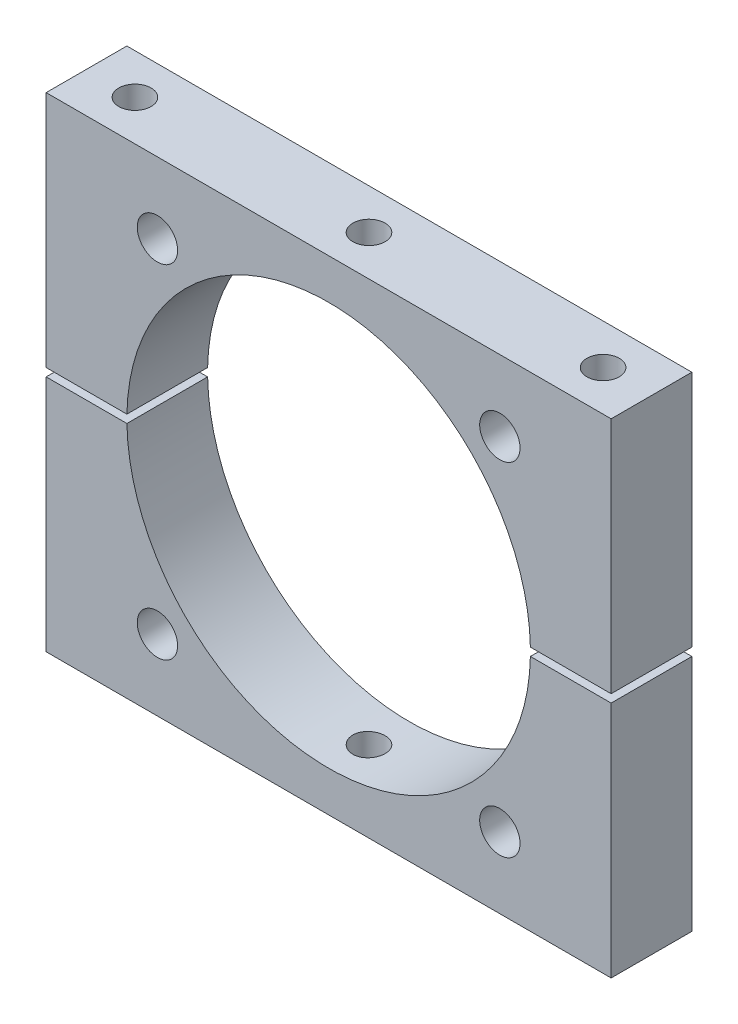
from build123d import *

# Parameters (mm, degrees)
SKETCH1_W           = 70
SKETCH1_H           = 60
BOSS_EXTRUDE1_DEPTH = 10
CUT_EXTRUDE1_DEPTH  = 10
SKETCH3_R           = 2
CUT_EXTRUDE2_DEPTH  = 93.736184955
SKETCH6_R           = 2.5
CUT_EXTRUDE3_DEPTH  = 93.73618503


with BuildPart() as part:
    # Sketch1 → Boss-Extrude1 (new body)
    with BuildSketch(Plane.XY):
        with Locations((35, 30)):
            Rectangle(SKETCH1_W, SKETCH1_H)
    extrude(amount=BOSS_EXTRUDE1_DEPTH)

    # Sketch2 → Cut-Extrude1 (cut)
    with BuildSketch(Plane.XY.offset(10)):
        with BuildLine():
            Line((10.0050005, 30.5), (0, 30.5))
            Line((0, 30.5), (0, 29.5))
            Line((0, 29.5), (10.0050005, 29.5))
            ThreePointArc((10.0050005, 29.5), (35, 5), (59.9949995, 29.5))
            Line((59.9949995, 29.5), (70, 29.5))
            Line((70, 29.5), (70, 30.5))
            Line((70, 30.5), (59.9949995, 30.5))
            ThreePointArc((59.9949995, 30.5), (35, 55), (10.0050005, 30.5))
        make_face()
    extrude(amount=-CUT_EXTRUDE1_DEPTH, mode=Mode.SUBTRACT)


with BuildPart() as cut_extrude1_piece_1:
    # of the separate pieces the step leaves, piece 1, a body of its own (cut_extrude1_pieces)
    add(part.part.solids().sort_by_distance((0, 0, 0))[0])


with BuildPart() as cut_extrude1_piece_2:
    # of the separate pieces the step leaves, piece 2, a body of its own (cut_extrude1_pieces)
    add(part.part.solids().sort_by_distance((0, 60, 0))[0])


with BuildPart() as cut_extrude2_tool:
    # Sketch3 → Cut-Extrude2 (new, through all)
    with BuildSketch(Plane(origin=(0, 60, 0), x_dir=(1, 0, 0), z_dir=(0, 1, 0))):
        with Locations(Location((6, -5, 0), (0, 0, 180))):
            Circle(SKETCH3_R)
        with Locations(Location((64, -5, 0), (0, 0, 180))):
            Circle(SKETCH3_R)
        with Locations(Location((35, -5, 0), (0, 0, 180))):
            Circle(SKETCH3_R)
    extrude(amount=-CUT_EXTRUDE2_DEPTH)


with BuildPart() as cut_extrude1_piece_1_1:
    add(cut_extrude1_piece_1.part)

    # Cut-Extrude2: cut by cut_extrude2_tool
    add(cut_extrude2_tool.part, mode=Mode.SUBTRACT)


with BuildPart() as cut_extrude1_piece_2_1:
    add(cut_extrude1_piece_2.part)

    # Cut-Extrude2: cut by cut_extrude2_tool
    add(cut_extrude2_tool.part, mode=Mode.SUBTRACT)


with BuildPart() as cut_extrude3_tool:
    # Sketch6 → Cut-Extrude3 (new, through all)
    with BuildSketch(Plane.XY.offset(10)):
        with Locations((13.786796564, 51.213203436)):
            Circle(SKETCH6_R)
        with Locations((56.213203436, 51.213203436)):
            Circle(SKETCH6_R)
        with Locations((56.213203436, 8.786796564)):
            Circle(SKETCH6_R)
        with Locations((13.786796564, 8.786796564)):
            Circle(SKETCH6_R)
    extrude(amount=-CUT_EXTRUDE3_DEPTH)


with BuildPart() as cut_extrude1_piece_1_2:
    add(cut_extrude1_piece_1_1.part)

    # Cut-Extrude3: cut by cut_extrude3_tool
    add(cut_extrude3_tool.part, mode=Mode.SUBTRACT)


with BuildPart() as cut_extrude1_piece_2_2:
    add(cut_extrude1_piece_2_1.part)

    # Cut-Extrude3: cut by cut_extrude3_tool
    add(cut_extrude3_tool.part, mode=Mode.SUBTRACT)


solid = Compound([cut_extrude1_piece_1_2.part, cut_extrude1_piece_2_2.part])
